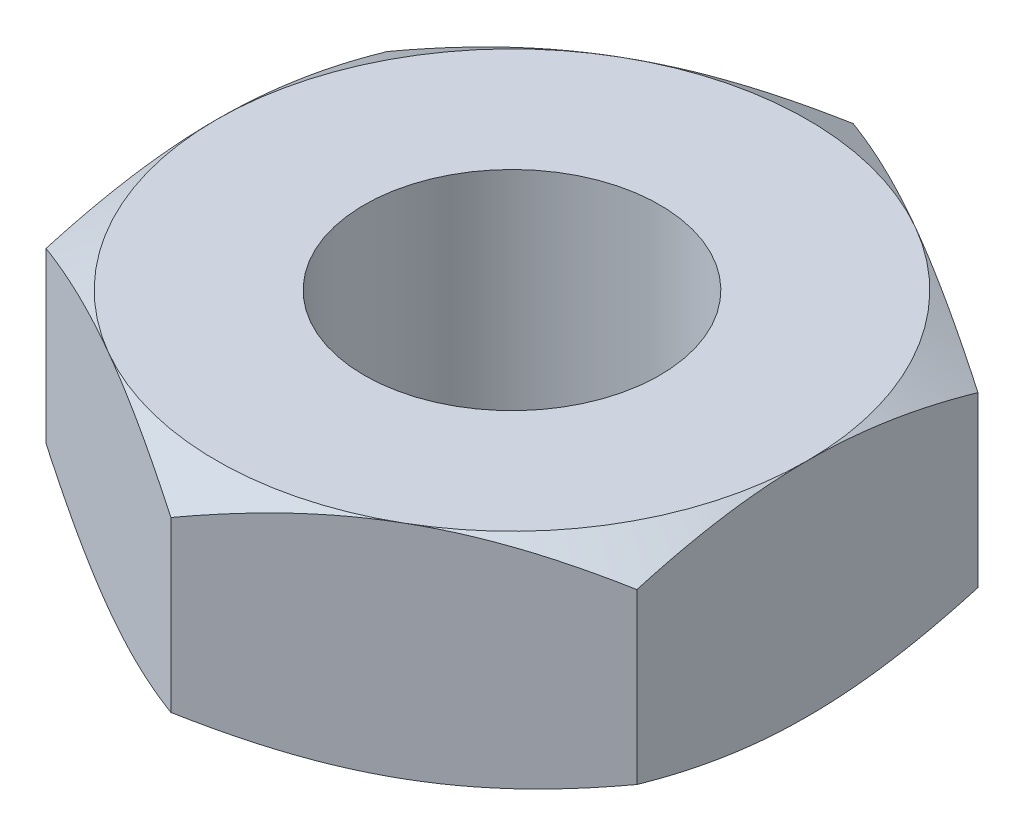
from build123d import *

# Parameters (mm, degrees)
SKETCH1_R           = 1
BOSS_EXTRUDE1_DEPTH = 1.5
SKETCH2_OUTSIDE_W   = 14.186
SKETCH2_OUTSIDE_H   = 14.804
SKETCH2_OUTSIDE_R   = 2
CUT_EXTRUDE1_DEPTH  = 2
CUT_EXTRUDE1_DRAFT  = -60
SKETCH3_OUTSIDE_W   = 14.186
SKETCH3_OUTSIDE_H   = 14.804
SKETCH3_OUTSIDE_R   = 2
CUT_EXTRUDE2_DEPTH  = 2
CUT_EXTRUDE2_DRAFT  = -60


with BuildPart() as part:
    # Sketch1 → Boss-Extrude1 (new body)
    with BuildSketch(Plane(origin=(0, 0, 0), x_dir=(1, 0, 0), z_dir=(0, 1, 0))):
        Polygon((0, -2.309401077), (2, -1.154700538), (2, 1.154700538), (0, 2.309401077), (-2, 1.154700538), (-2, -1.154700538), align=None)
        with Locations(Location((0, 0, 0), (0, 0, 270))):
            Circle(SKETCH1_R, mode=Mode.SUBTRACT)
    extrude(amount=BOSS_EXTRUDE1_DEPTH)


with BuildPart() as cut_extrude1_tool:
    # Sketch2 outside → Cut-Extrude1 (with draft: the straight prism first)
    with BuildSketch(Plane(origin=(0, 1.5, 0), x_dir=(1, 0, 0), z_dir=(0, 1, 0))):
        Rectangle(SKETCH2_OUTSIDE_W, SKETCH2_OUTSIDE_H)
        Circle(SKETCH2_OUTSIDE_R, mode=Mode.SUBTRACT)
    extrude(amount=-CUT_EXTRUDE1_DEPTH)
    # Cut-Extrude1: the draft: its side faces are tilted about the plane it starts from
    cut_extrude1_sides = [cut_extrude1_tool.faces().sort_by_distance(p)[0] for p in [
        (0, 0.5, 7.402),
        (7.093, 0.5, 0),
        (0, 0.5, -7.402),
        (-7.093, 0.5, 0),
        (-2, 0.5, 0),
    ]]
    draft(cut_extrude1_sides, Plane(origin=(0, 1.5, 0), x_dir=(1, 0, 0), z_dir=(0, 1, 0)), CUT_EXTRUDE1_DRAFT)


with BuildPart() as part_1:
    add(part.part)

    # Cut-Extrude1: cut by cut_extrude1_tool
    add(cut_extrude1_tool.part, mode=Mode.SUBTRACT)


with BuildPart() as cut_extrude2_tool:
    # Sketch3 outside → Cut-Extrude2 (with draft: the straight prism first)
    with BuildSketch(Plane.XZ):
        Rectangle(SKETCH3_OUTSIDE_W, SKETCH3_OUTSIDE_H)
        Circle(SKETCH3_OUTSIDE_R, mode=Mode.SUBTRACT)
    extrude(amount=-CUT_EXTRUDE2_DEPTH)
    # Cut-Extrude2: the draft: its side faces are tilted about the plane it starts from
    cut_extrude2_sides = [cut_extrude2_tool.faces().sort_by_distance(p)[0] for p in [
        (0, 1, -7.402),
        (7.093, 1, 0),
        (0, 1, 7.402),
        (-7.093, 1, 0),
        (-2, 1, 0),
    ]]
    draft(cut_extrude2_sides, Plane.XZ, CUT_EXTRUDE2_DRAFT)


with BuildPart() as part_2:
    add(part_1.part)

    # Cut-Extrude2: cut by cut_extrude2_tool
    add(cut_extrude2_tool.part, mode=Mode.SUBTRACT)


solid = part_2.part
